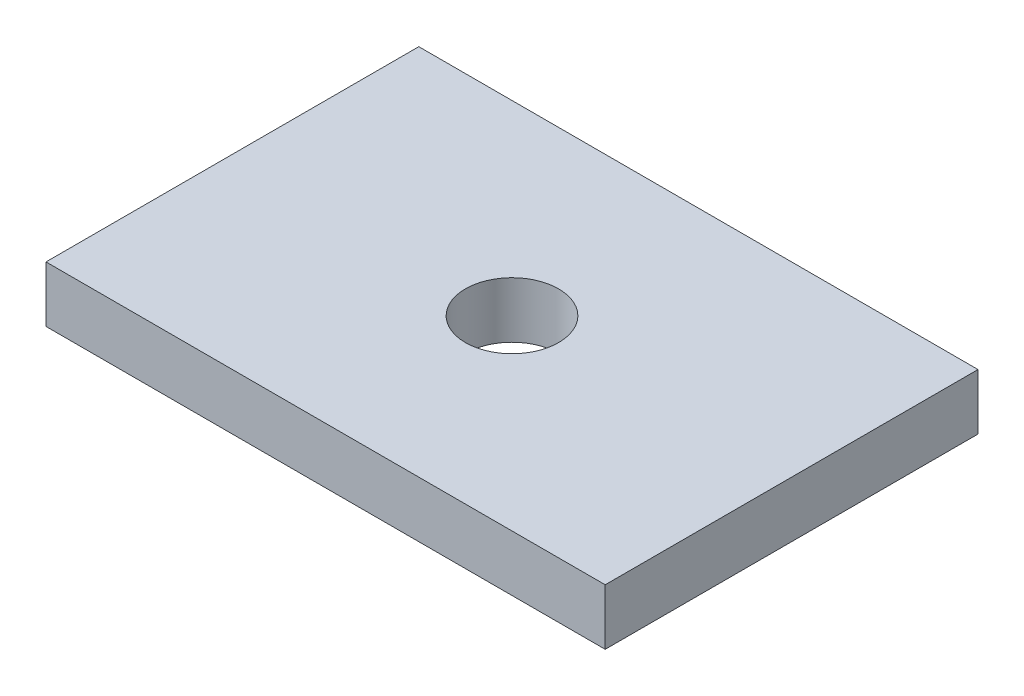
from build123d import *

# Parameters (mm, degrees)
SKETCH1_W           = 60
SKETCH1_H           = 40
BOSS_EXTRUDE1_DEPTH = 6
SKETCH2_R           = 5
CUT_EXTRUDE1_DEPTH  = 6


with BuildPart() as part:
    # Sketch1 → Boss-Extrude1 (new body)
    with BuildSketch(Plane(origin=(0, 0, 0), x_dir=(1, 0, 0), z_dir=(0, 1, 0))):
        Rectangle(SKETCH1_W, SKETCH1_H)
    extrude(amount=BOSS_EXTRUDE1_DEPTH)

    # Sketch2 → Cut-Extrude1 (cut)
    with BuildSketch(Plane(origin=(0, 6, 0), x_dir=(1, 0, 0), z_dir=(0, 1, 0))):
        with Locations(Location((0, 0, 0), (0, 0, 270))):
            Circle(SKETCH2_R)
    extrude(amount=-CUT_EXTRUDE1_DEPTH, mode=Mode.SUBTRACT)


solid = part.part
